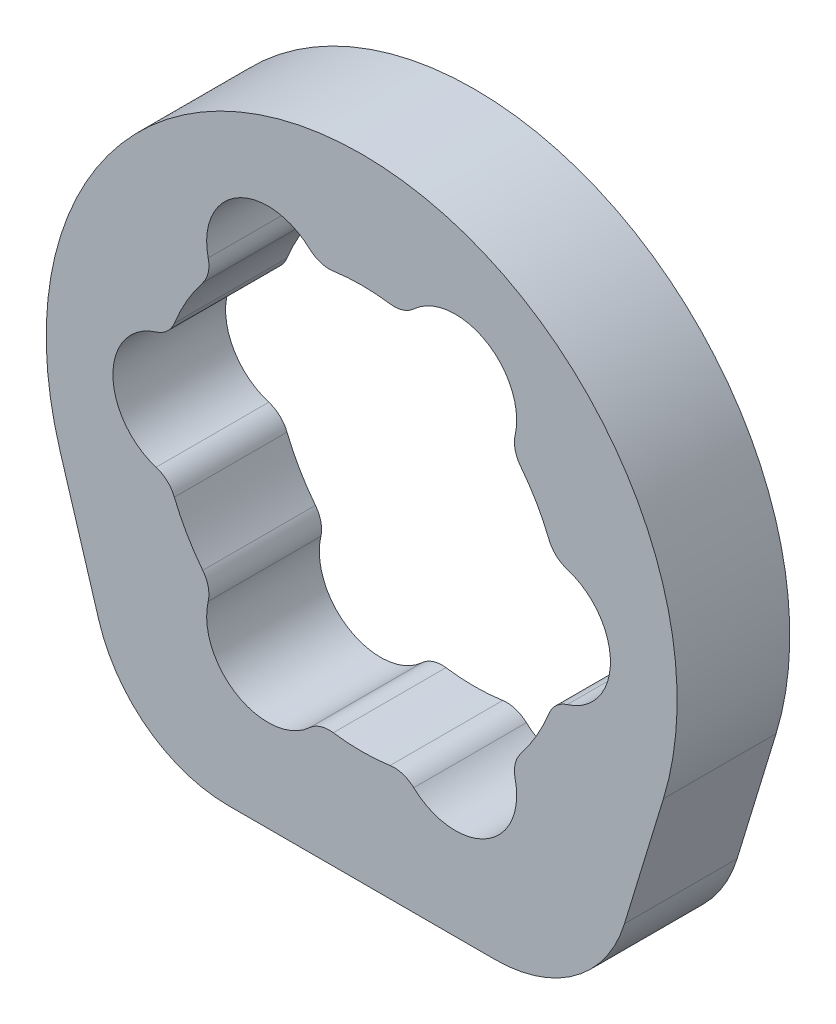
from build123d import *

# Parameters (mm, degrees)
BOSS_EXTRUDE1_DEPTH = 3.96875
FILLET2_R           = 2.032
FILLET3_R           = 9.525


with BuildPart() as part:
    # Sketch1 → Boss-Extrude1 (new, symmetric)
    with BuildSketch(Plane.XY):
        with BuildLine():
            Line((-21.258657525, -6.482291667), (-16.458315503, -22.225))
            Line((-16.458315503, -22.225), (16.458315503, -22.225))
            Line((16.458315503, -22.225), (21.258657525, -6.482291667))
            ThreePointArc((21.258657525, -6.482291667), (0, 22.225), (-21.258657525, -6.482291667))
        make_face()
        with BuildLine():
            ThreePointArc((13.55725, 4.303852743), (17.526, 0), (13.55725, -4.303852743))
            ThreePointArc((13.55725, -4.303852743), (12.318345343, -7.112), (10.50587081, -9.588996534))
            ThreePointArc((10.50587081, -9.588996534), (8.763, -15.177961227), (3.05137919, -13.892849277))
            ThreePointArc((3.05137919, -13.892849277), (0, -14.224), (-3.05137919, -13.892849277))
            ThreePointArc((-3.05137919, -13.892849277), (-8.763, -15.177961227), (-10.50587081, -9.588996534))
            ThreePointArc((-10.50587081, -9.588996534), (-12.318345343, -7.112), (-13.55725, -4.303852743))
            ThreePointArc((-13.55725, -4.303852743), (-17.526, 0), (-13.55725, 4.303852743))
            ThreePointArc((-13.55725, 4.303852743), (-12.318345343, 7.112), (-10.50587081, 9.588996534))
            ThreePointArc((-10.50587081, 9.588996534), (-8.763, 15.177961227), (-3.05137919, 13.892849277))
            ThreePointArc((-3.05137919, 13.892849277), (0, 14.224), (3.05137919, 13.892849277))
            ThreePointArc((3.05137919, 13.892849277), (8.763, 15.177961227), (10.50587081, 9.588996534))
            ThreePointArc((10.50587081, 9.588996534), (12.318345343, 7.112), (13.55725, 4.303852743))
        make_face(mode=Mode.SUBTRACT)
    extrude(amount=BOSS_EXTRUDE1_DEPTH, both=True)

    # Fillet2
    fillet2_edges = [part.edges().sort_by_distance(p)[0] for p in [
        (-13.55725, -4.303852743, 0),
        (-10.50587081, -9.588996534, 0),
        (-3.05137919, -13.892849277, 0),
        (3.05137919, -13.892849277, 0),
        (10.50587081, -9.588996534, 0),
        (13.55725, -4.303852743, 0),
        (13.55725, 4.303852743, 0),
        (10.50587081, 9.588996534, 0),
        (3.05137919, 13.892849277, 0),
        (-3.05137919, 13.892849277, 0),
        (-10.50587081, 9.588996534, 0),
        (-13.55725, 4.303852743, 0),
    ]]
    fillet(fillet2_edges, radius=FILLET2_R)

    # Fillet3
    fillet3_edges = [part.edges().sort_by_distance(p)[0] for p in [
        (16.458315503, -22.225, 0),
        (-16.458315503, -22.225, 0),
    ]]
    fillet(fillet3_edges, radius=FILLET3_R)


solid = part.part
